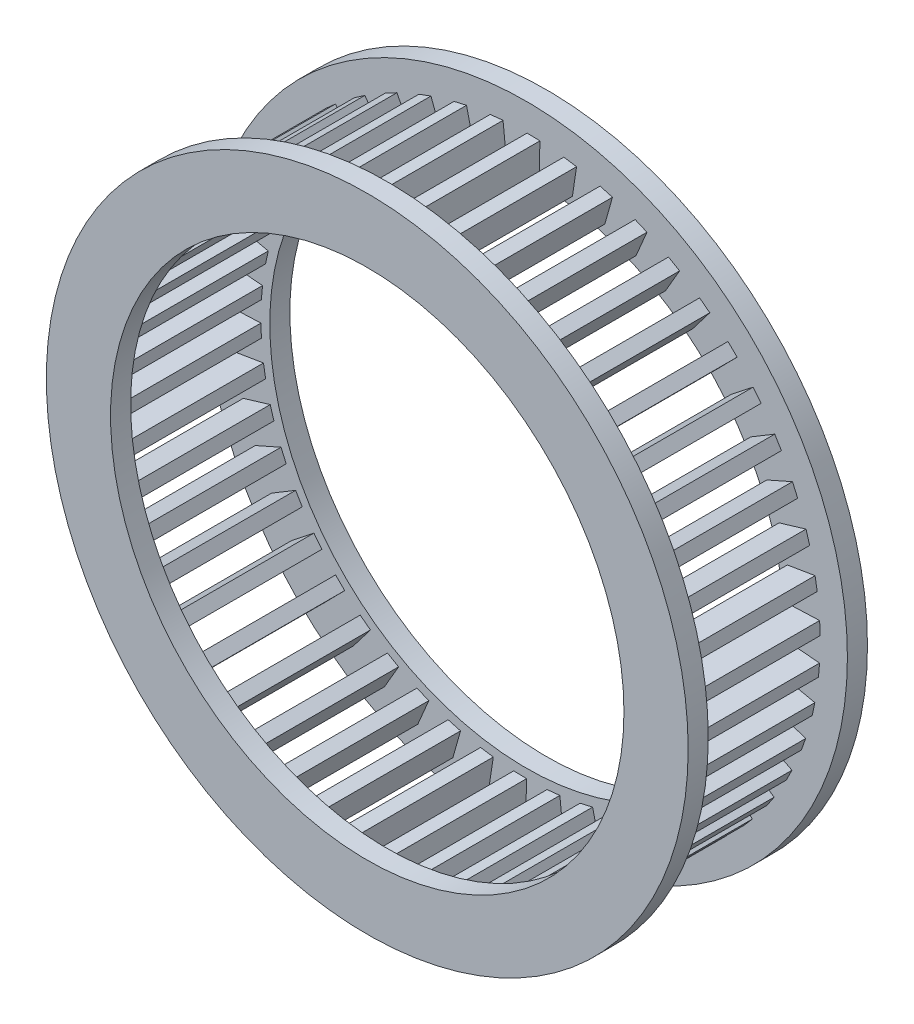
from build123d import *

# Parameters (mm, degrees)
CAGE_50_BARS_START    = -20.1
CAGE_50_BARS_DEPTH    = 40.2
CAGE_50_BARS_2_DEPTH  = 40.2
CAGE_50_BARS_3_DEPTH  = 40.2
CAGE_50_BARS_4_DEPTH  = 40.2
CAGE_50_BARS_5_DEPTH  = 40.2
CAGE_50_BARS_6_DEPTH  = 40.2
CAGE_50_BARS_7_DEPTH  = 40.2
CAGE_50_BARS_8_DEPTH  = 40.2
CAGE_50_BARS_9_DEPTH  = 40.2
CAGE_50_BARS_10_DEPTH = 40.2
CAGE_50_BARS_11_DEPTH = 40.2
CAGE_50_BARS_12_DEPTH = 40.2
CAGE_50_BARS_13_DEPTH = 40.2
CAGE_50_BARS_14_DEPTH = 40.2
CAGE_50_BARS_15_DEPTH = 40.2
CAGE_50_BARS_16_DEPTH = 40.2
CAGE_50_BARS_17_DEPTH = 40.2
CAGE_50_BARS_18_DEPTH = 40.2
CAGE_50_BARS_19_DEPTH = 40.2
CAGE_50_BARS_20_DEPTH = 40.2
CAGE_50_BARS_21_DEPTH = 40.2
CAGE_50_BARS_22_DEPTH = 40.2
CAGE_50_BARS_23_DEPTH = 40.2
CAGE_50_BARS_24_DEPTH = 40.2
CAGE_50_BARS_25_DEPTH = 40.2
CAGE_50_BARS_26_DEPTH = 40.2
CAGE_50_BARS_27_DEPTH = 40.2
CAGE_50_BARS_28_DEPTH = 40.2
CAGE_50_BARS_29_DEPTH = 40.2
CAGE_50_BARS_30_DEPTH = 40.2
CAGE_50_BARS_31_DEPTH = 40.2
CAGE_50_BARS_32_DEPTH = 40.2
CAGE_50_BARS_33_DEPTH = 40.2
CAGE_50_BARS_34_DEPTH = 40.2
CAGE_50_BARS_35_DEPTH = 40.2
CAGE_50_BARS_36_DEPTH = 40.2
CAGE_50_BARS_37_DEPTH = 40.2
CAGE_50_BARS_38_DEPTH = 40.2
CAGE_50_BARS_39_DEPTH = 40.2
CAGE_50_BARS_40_DEPTH = 40.2
CAGE_50_BARS_41_DEPTH = 40.2
CAGE_50_BARS_42_DEPTH = 40.2
CAGE_50_BARS_43_DEPTH = 40.2
CAGE_50_BARS_44_DEPTH = 40.2
CAGE_50_BARS_45_DEPTH = 40.2
CAGE_50_BARS_46_DEPTH = 40.2
CAGE_50_BARS_47_DEPTH = 40.2
CAGE_50_BARS_48_DEPTH = 40.2
CAGE_50_BARS_49_DEPTH = 40.2
CAGE_50_BARS_50_DEPTH = 40.2
CAGE_RING_RIGHT_START = 20
SKETCH_2_R            = 92.246153846
SKETCH_2_R_2          = 73.784615385
CAGE_RING_RIGHT_DEPTH = 5.769230769
CAGE_RING_LEFT_START  = -25.769230769
SKETCH_3_R            = 92.246153846
SKETCH_3_R_2          = 73.784615385
CAGE_RING_LEFT_DEPTH  = 5.769230769


with BuildPart() as part:
    # Эскиз1 → Cage_50_bars (new body)
    with BuildSketch(Plane.XY.offset(CAGE_50_BARS_START)):
        Polygon((76.337072307, 1.127717467), (84.40786759, 1.44228048), (84.264067355, 5.131786895), (76.193272072, 4.817223882), align=None)
    extrude(amount=CAGE_50_BARS_DEPTH)



with BuildPart() as body_2:
    # Эскиз1 → Cage_50_bars 2 (new body)
    with BuildSketch(Plane.XY.offset(CAGE_50_BARS_START)):
        Polygon((75.593791214, 10.686397191), (83.561520666, 12.01001865), (82.95643657, 15.652409257), (74.988707118, 14.328787798), align=None)
    extrude(amount=CAGE_50_BARS_2_DEPTH)


with BuildPart() as body_3:
    # Эскиз1 → Cage_50_bars 3 (new body)
    with BuildSketch(Plane.XY.offset(CAGE_50_BARS_START)):
        Polygon((73.658350876, 20.076546048), (81.397358644, 22.388351653), (80.340533225, 25.926183775), (72.601525457, 23.61437817), align=None)
    extrude(amount=CAGE_50_BARS_3_DEPTH)


with BuildPart() as body_4:
    # Эскиз1 → Cage_50_bars 4 (new body)
    with BuildSketch(Plane.XY.offset(CAGE_50_BARS_START)):
        Polygon((70.561274344, 29.15007578), (77.949511652, 32.413606975), (76.457611677, 35.791086888), (69.069374369, 32.527555692), align=None)
    extrude(amount=CAGE_50_BARS_4_DEPTH)


with BuildPart() as body_5:
    # Эскиз1 → Cage_50_bars 5 (new body)
    with BuildSketch(Plane.XY.offset(CAGE_50_BARS_START)):
        Polygon((66.351404364, 37.763891404), (73.272354297, 41.927680353), (71.36890792, 45.09154318), (64.447957987, 40.92775423), align=None)
    extrude(amount=CAGE_50_BARS_5_DEPTH)


with BuildPart() as body_6:
    # Эскиз1 → Cage_50_bars 6 (new body)
    with BuildSketch(Plane.XY.offset(CAGE_50_BARS_START)):
        Polygon((61.095133101, 45.782147901), (67.439648143, 50.780529165), (65.154673851, 53.680878899), (58.810158809, 48.682497635), align=None)
    extrude(amount=CAGE_50_BARS_6_DEPTH)


with BuildPart() as body_7:
    # Эскиз1 → Cage_50_bars 7 (new body)
    with BuildSketch(Plane.XY.offset(CAGE_50_BARS_START)):
        Polygon((54.875355092, 53.078392577), (60.543378452, 58.832538698), (57.912911654, 61.423635091), (52.244888294, 55.66948897), align=None)
    extrude(amount=CAGE_50_BARS_7_DEPTH)


with BuildPart() as body_8:
    # Эскиз1 → Cage_50_bars 8 (new body)
    with BuildSketch(Plane.XY.offset(CAGE_50_BARS_START)):
        Polygon((47.790159953, 59.537559294), (52.692303516, 65.95672395), (49.757828245, 68.197703865), (44.855684682, 61.778539209), align=None)
    extrude(amount=CAGE_50_BARS_8_DEPTH)


with BuildPart() as body_9:
    # Эскиз1 → Cage_50_bars 9 (new body)
    with BuildSketch(Plane.XY.offset(CAGE_50_BARS_START)):
        Polygon((39.951285442, 65.057783136), (44.010239476, 72.040732265), (40.81803416, 73.896254109), (36.759080126, 66.91330498), align=None)
    extrude(amount=CAGE_50_BARS_9_DEPTH)


with BuildPart() as body_10:
    # Эскиз1 → Cage_50_bars 10 (new body)
    with BuildSketch(Plane.XY.offset(CAGE_50_BARS_START)):
        Polygon((31.482355295, 69.552006873), (34.63410767, 76.988615197), (31.234515293, 78.429416283), (28.082762918, 70.992807959), align=None)
    extrude(amount=CAGE_50_BARS_10_DEPTH)


with BuildPart() as body_11:
    # Эскиз1 → Cage_50_bars 11 (new body)
    with BuildSketch(Plane.XY.offset(CAGE_50_BARS_START)):
        Polygon((22.516929598, 72.949353914), (24.711775296, 80.722341677), (21.158409462, 81.72569971), (18.963563764, 73.952711948), align=None)
    extrude(amount=CAGE_50_BARS_11_DEPTH)


with BuildPart() as body_12:
    # Эскиз1 → Cage_50_bars 12 (new body)
    with BuildSketch(Plane.XY.offset(CAGE_50_BARS_START)):
        Polygon((13.19639847, 75.196246066), (14.399723463, 83.183028607), (10.748622873, 83.733120032), (9.54529788, 75.746337492), align=None)
    extrude(amount=CAGE_50_BARS_12_DEPTH)


with BuildPart() as body_13:
    # Эскиз1 → Cage_50_bars 13 (new body)
    with BuildSketch(Plane.XY.offset(CAGE_50_BARS_START)):
        Polygon((3.667752255, 76.257248498), (3.86057939, 84.331869485), (0.169324081, 84.420019032), (-0.023503053, 76.345398045), align=None)
    extrude(amount=CAGE_50_BARS_13_DEPTH)


with BuildPart() as body_14:
    # Эскиз1 → Cage_50_bars 14 (new body)
    with BuildSketch(Plane.XY.offset(CAGE_50_BARS_START)):
        Polygon((-5.918736604, 76.115628566), (-6.739448327, 84.150746404), (-10.412645052, 83.775563902), (-9.591933329, 75.740446064), align=None)
    extrude(amount=CAGE_50_BARS_14_DEPTH)


with BuildPart() as body_15:
    # Эскиз1 → Cage_50_bars 15 (new body)
    with BuildSketch(Plane.XY.offset(CAGE_50_BARS_START)):
        Polygon((-15.411883451, 74.773619703), (-17.233190917, 82.642515782), (-20.830400554, 81.809918083), (-19.009093087, 73.941022004), align=None)
    extrude(amount=CAGE_50_BARS_15_DEPTH)


with BuildPart() as body_16:
    # Эскиз1 → Cage_50_bars 16 (new body)
    with BuildSketch(Plane.XY.offset(CAGE_50_BARS_START)):
        Polygon((-24.661975689, 72.25238619), (-27.455155793, 79.830963319), (-30.919648194, 78.554080986), (-28.126468091, 70.975503857), align=None)
    extrude(amount=CAGE_50_BARS_16_DEPTH)


with BuildPart() as body_17:
    # Эскиз1 → Cage_50_bars 17 (new body)
    with BuildSketch(Plane.XY.offset(CAGE_50_BARS_START)):
        Polygon((-33.523133839, 68.591689385), (-37.24413646, 75.760428875), (-40.521274513, 74.059399106), (-36.800271892, 66.890659615), align=None)
    extrude(amount=CAGE_50_BARS_17_DEPTH)


with BuildPart() as body_18:
    # Эскиз1 → Cage_50_bars 18 (new body)
    with BuildSketch(Plane.XY.offset(CAGE_50_BARS_START)):
        Polygon((-41.855612142, 63.849260663), (-46.445754847, 70.495107211), (-49.483856126, 68.39675626), (-44.893713421, 61.750909713), align=None)
    extrude(amount=CAGE_50_BARS_18_DEPTH)


with BuildPart() as body_19:
    # Эскиз1 → Cage_50_bars 19 (new body)
    with BuildSketch(Plane.XY.offset(CAGE_50_BARS_START)):
        Polygon((-49.528002438, 58.09989096), (-54.914895935, 64.118035595), (-57.666047768, 61.655455711), (-52.279154271, 55.637311076), align=None)
    extrude(amount=CAGE_50_BARS_19_DEPTH)


with BuildPart() as body_20:
    # Эскиз1 → Cage_50_bars 20 (new body)
    with BuildSketch(Plane.XY.offset(CAGE_50_BARS_START)):
        Polygon((-56.419306549, 51.434251268), (-62.517996309, 56.729784255), (-64.938811388, 53.941811793), (-58.840121629, 48.646278807), align=None)
    extrude(amount=CAGE_50_BARS_20_DEPTH)


with BuildPart() as body_21:
    # Эскиз1 → Cage_50_bars 21 (new body)
    with BuildSketch(Plane.XY.offset(CAGE_50_BARS_START)):
        Polygon((-62.420844493, 43.957462709), (-69.135150535, 48.446870328), (-71.18745116, 45.37747328), (-64.473145119, 40.888065662), align=None)
    extrude(amount=CAGE_50_BARS_21_DEPTH)


with BuildPart() as body_22:
    # Эскиз1 → Cage_50_bars 22 (new body)
    with BuildSketch(Plane.XY.offset(CAGE_50_BARS_START)):
        Polygon((-67.43796843, 35.787438704), (-74.662002137, 39.399920316), (-76.313422303, 36.097504907), (-69.089388596, 32.485023295), align=None)
    extrude(amount=CAGE_50_BARS_22_DEPTH)


with BuildPart() as body_23:
    # Эскиз1 → Cage_50_bars 23 (new body)
    with BuildSketch(Plane.XY.offset(CAGE_50_BARS_START)):
        Polygon((-71.39155532, 27.053025412), (-79.011389365, 29.731610024), (-80.235885188, 26.248257317), (-72.616051143, 23.569672706), align=None)
    extrude(amount=CAGE_50_BARS_23_DEPTH)


with BuildPart() as body_24:
    # Эскиз1 → Cage_50_bars 24 (new body)
    with BuildSketch(Plane.XY.offset(CAGE_50_BARS_START)):
        Polygon((-74.219254736, 17.891969749), (-82.114719784, 19.594414481), (-82.892980233, 15.98505903), (-74.997515184, 14.282614299), align=None)
    extrude(amount=CAGE_50_BARS_24_DEPTH)


with BuildPart() as body_25:
    # Эскиз1 → Cage_50_bars 25 (new body)
    with BuildSketch(Plane.XY.offset(CAGE_50_BARS_START)):
        Polygon((-75.876472167, 8.448747035), (-83.923052019, 9.148203316), (-84.242803461, 5.469766813), (-76.19622361, 4.770310531), align=None)
    extrude(amount=CAGE_50_BARS_25_DEPTH)


with BuildPart() as body_26:
    # Эскиз1 → Cage_50_bars 26 (new body)
    with BuildSketch(Plane.XY.offset(CAGE_50_BARS_START)):
        Polygon((-76.337072307, -1.127717467), (-84.40786759, -1.44228048), (-84.264067355, -5.131786895), (-76.193272072, -4.817223882), align=None)
    extrude(amount=CAGE_50_BARS_26_DEPTH)


with BuildPart() as body_27:
    # Эскиз1 → Cage_50_bars 27 (new body)
    with BuildSketch(Plane.XY.offset(CAGE_50_BARS_START)):
        Polygon((-75.593791214, -10.686397191), (-83.561520666, -12.01001865), (-82.95643657, -15.652409257), (-74.988707118, -14.328787798), align=None)
    extrude(amount=CAGE_50_BARS_27_DEPTH)


with BuildPart() as body_28:
    # Эскиз1 → Cage_50_bars 28 (new body)
    with BuildSketch(Plane.XY.offset(CAGE_50_BARS_START)):
        Polygon((-73.658350876, -20.076546048), (-81.397358644, -22.388351653), (-80.340533225, -25.926183775), (-72.601525457, -23.61437817), align=None)
    extrude(amount=CAGE_50_BARS_28_DEPTH)


with BuildPart() as body_29:
    # Эскиз1 → Cage_50_bars 29 (new body)
    with BuildSketch(Plane.XY.offset(CAGE_50_BARS_START)):
        Polygon((-70.561274344, -29.15007578), (-77.949511652, -32.413606975), (-76.457611677, -35.791086888), (-69.069374369, -32.527555692), align=None)
    extrude(amount=CAGE_50_BARS_29_DEPTH)


with BuildPart() as body_30:
    # Эскиз1 → Cage_50_bars 30 (new body)
    with BuildSketch(Plane.XY.offset(CAGE_50_BARS_START)):
        Polygon((-66.351404364, -37.763891404), (-73.272354297, -41.927680353), (-71.36890792, -45.09154318), (-64.447957987, -40.92775423), align=None)
    extrude(amount=CAGE_50_BARS_30_DEPTH)


with BuildPart() as body_31:
    # Эскиз1 → Cage_50_bars 31 (new body)
    with BuildSketch(Plane.XY.offset(CAGE_50_BARS_START)):
        Polygon((-61.095133101, -45.782147901), (-67.439648143, -50.780529165), (-65.154673851, -53.680878899), (-58.810158809, -48.682497635), align=None)
    extrude(amount=CAGE_50_BARS_31_DEPTH)


with BuildPart() as body_32:
    # Эскиз1 → Cage_50_bars 32 (new body)
    with BuildSketch(Plane.XY.offset(CAGE_50_BARS_START)):
        Polygon((-54.875355092, -53.078392577), (-60.543378452, -58.832538698), (-57.912911654, -61.423635091), (-52.244888294, -55.66948897), align=None)
    extrude(amount=CAGE_50_BARS_32_DEPTH)


with BuildPart() as body_33:
    # Эскиз1 → Cage_50_bars 33 (new body)
    with BuildSketch(Plane.XY.offset(CAGE_50_BARS_START)):
        Polygon((-47.790159953, -59.537559294), (-52.692303516, -65.95672395), (-49.757828245, -68.197703865), (-44.855684682, -61.778539209), align=None)
    extrude(amount=CAGE_50_BARS_33_DEPTH)


with BuildPart() as body_34:
    # Эскиз1 → Cage_50_bars 34 (new body)
    with BuildSketch(Plane.XY.offset(CAGE_50_BARS_START)):
        Polygon((-39.951285442, -65.057783136), (-44.010239476, -72.040732265), (-40.81803416, -73.896254109), (-36.759080126, -66.91330498), align=None)
    extrude(amount=CAGE_50_BARS_34_DEPTH)


with BuildPart() as body_35:
    # Эскиз1 → Cage_50_bars 35 (new body)
    with BuildSketch(Plane.XY.offset(CAGE_50_BARS_START)):
        Polygon((-31.482355295, -69.552006873), (-34.63410767, -76.988615197), (-31.234515293, -78.429416283), (-28.082762918, -70.992807959), align=None)
    extrude(amount=CAGE_50_BARS_35_DEPTH)


with BuildPart() as body_36:
    # Эскиз1 → Cage_50_bars 36 (new body)
    with BuildSketch(Plane.XY.offset(CAGE_50_BARS_START)):
        Polygon((-22.516929598, -72.949353914), (-24.711775296, -80.722341677), (-21.158409462, -81.72569971), (-18.963563764, -73.952711948), align=None)
    extrude(amount=CAGE_50_BARS_36_DEPTH)


with BuildPart() as body_37:
    # Эскиз1 → Cage_50_bars 37 (new body)
    with BuildSketch(Plane.XY.offset(CAGE_50_BARS_START)):
        Polygon((-13.19639847, -75.196246066), (-14.399723463, -83.183028607), (-10.748622873, -83.733120032), (-9.54529788, -75.746337492), align=None)
    extrude(amount=CAGE_50_BARS_37_DEPTH)


with BuildPart() as body_38:
    # Эскиз1 → Cage_50_bars 38 (new body)
    with BuildSketch(Plane.XY.offset(CAGE_50_BARS_START)):
        Polygon((-3.667752255, -76.257248498), (-3.86057939, -84.331869485), (-0.169324081, -84.420019032), (0.023503053, -76.345398045), align=None)
    extrude(amount=CAGE_50_BARS_38_DEPTH)


with BuildPart() as body_39:
    # Эскиз1 → Cage_50_bars 39 (new body)
    with BuildSketch(Plane.XY.offset(CAGE_50_BARS_START)):
        Polygon((5.918736604, -76.115628566), (6.739448327, -84.150746404), (10.412645052, -83.775563902), (9.591933329, -75.740446064), align=None)
    extrude(amount=CAGE_50_BARS_39_DEPTH)


with BuildPart() as body_40:
    # Эскиз1 → Cage_50_bars 40 (new body)
    with BuildSketch(Plane.XY.offset(CAGE_50_BARS_START)):
        Polygon((15.411883451, -74.773619703), (17.233190917, -82.642515782), (20.830400554, -81.809918083), (19.009093087, -73.941022004), align=None)
    extrude(amount=CAGE_50_BARS_40_DEPTH)


with BuildPart() as body_41:
    # Эскиз1 → Cage_50_bars 41 (new body)
    with BuildSketch(Plane.XY.offset(CAGE_50_BARS_START)):
        Polygon((24.661975689, -72.25238619), (27.455155793, -79.830963319), (30.919648194, -78.554080986), (28.126468091, -70.975503857), align=None)
    extrude(amount=CAGE_50_BARS_41_DEPTH)


with BuildPart() as body_42:
    # Эскиз1 → Cage_50_bars 42 (new body)
    with BuildSketch(Plane.XY.offset(CAGE_50_BARS_START)):
        Polygon((33.523133839, -68.591689385), (37.24413646, -75.760428875), (40.521274513, -74.059399106), (36.800271892, -66.890659615), align=None)
    extrude(amount=CAGE_50_BARS_42_DEPTH)


with BuildPart() as body_43:
    # Эскиз1 → Cage_50_bars 43 (new body)
    with BuildSketch(Plane.XY.offset(CAGE_50_BARS_START)):
        Polygon((41.855612142, -63.849260663), (46.445754847, -70.495107211), (49.483856126, -68.39675626), (44.893713421, -61.750909713), align=None)
    extrude(amount=CAGE_50_BARS_43_DEPTH)


with BuildPart() as body_44:
    # Эскиз1 → Cage_50_bars 44 (new body)
    with BuildSketch(Plane.XY.offset(CAGE_50_BARS_START)):
        Polygon((49.528002438, -58.09989096), (54.914895935, -64.118035595), (57.666047768, -61.655455711), (52.279154271, -55.637311076), align=None)
    extrude(amount=CAGE_50_BARS_44_DEPTH)


with BuildPart() as body_45:
    # Эскиз1 → Cage_50_bars 45 (new body)
    with BuildSketch(Plane.XY.offset(CAGE_50_BARS_START)):
        Polygon((56.419306549, -51.434251268), (62.517996309, -56.729784255), (64.938811388, -53.941811793), (58.840121629, -48.646278807), align=None)
    extrude(amount=CAGE_50_BARS_45_DEPTH)


with BuildPart() as body_46:
    # Эскиз1 → Cage_50_bars 46 (new body)
    with BuildSketch(Plane.XY.offset(CAGE_50_BARS_START)):
        Polygon((62.420844493, -43.957462709), (69.135150535, -48.446870328), (71.18745116, -45.37747328), (64.473145119, -40.888065662), align=None)
    extrude(amount=CAGE_50_BARS_46_DEPTH)


with BuildPart() as body_47:
    # Эскиз1 → Cage_50_bars 47 (new body)
    with BuildSketch(Plane.XY.offset(CAGE_50_BARS_START)):
        Polygon((67.43796843, -35.787438704), (74.662002137, -39.399920316), (76.313422303, -36.097504907), (69.089388596, -32.485023295), align=None)
    extrude(amount=CAGE_50_BARS_47_DEPTH)


with BuildPart() as body_48:
    # Эскиз1 → Cage_50_bars 48 (new body)
    with BuildSketch(Plane.XY.offset(CAGE_50_BARS_START)):
        Polygon((71.39155532, -27.053025412), (79.011389365, -29.731610024), (80.235885188, -26.248257317), (72.616051143, -23.569672706), align=None)
    extrude(amount=CAGE_50_BARS_48_DEPTH)


with BuildPart() as body_49:
    # Эскиз1 → Cage_50_bars 49 (new body)
    with BuildSketch(Plane.XY.offset(CAGE_50_BARS_START)):
        Polygon((74.219254736, -17.891969749), (82.114719784, -19.594414481), (82.892980233, -15.98505903), (74.997515184, -14.282614299), align=None)
    extrude(amount=CAGE_50_BARS_49_DEPTH)


with BuildPart() as body_50:
    # Эскиз1 → Cage_50_bars 50 (new body)
    with BuildSketch(Plane.XY.offset(CAGE_50_BARS_START)):
        Polygon((75.876472167, -8.448747035), (83.923052019, -9.148203316), (84.242803461, -5.469766813), (76.19622361, -4.770310531), align=None)
    extrude(amount=CAGE_50_BARS_50_DEPTH)


with BuildPart() as part_1:
    add(part.part)

    add(body_2.part)  # Cage_ring_right merges body 2

    add(body_3.part)  # Cage_ring_right merges body 3

    add(body_4.part)  # Cage_ring_right merges body 4

    add(body_5.part)  # Cage_ring_right merges body 5

    add(body_6.part)  # Cage_ring_right merges body 6

    add(body_7.part)  # Cage_ring_right merges body 7

    add(body_8.part)  # Cage_ring_right merges body 8

    add(body_9.part)  # Cage_ring_right merges body 9

    add(body_10.part)  # Cage_ring_right merges body 10

    add(body_11.part)  # Cage_ring_right merges body 11

    add(body_12.part)  # Cage_ring_right merges body 12

    add(body_13.part)  # Cage_ring_right merges body 13

    add(body_14.part)  # Cage_ring_right merges body 14

    add(body_15.part)  # Cage_ring_right merges body 15

    add(body_16.part)  # Cage_ring_right merges body 16

    add(body_17.part)  # Cage_ring_right merges body 17

    add(body_18.part)  # Cage_ring_right merges body 18

    add(body_19.part)  # Cage_ring_right merges body 19

    add(body_20.part)  # Cage_ring_right merges body 20

    add(body_21.part)  # Cage_ring_right merges body 21

    add(body_22.part)  # Cage_ring_right merges body 22

    add(body_23.part)  # Cage_ring_right merges body 23

    add(body_24.part)  # Cage_ring_right merges body 24

    add(body_25.part)  # Cage_ring_right merges body 25

    add(body_26.part)  # Cage_ring_right merges body 26

    add(body_27.part)  # Cage_ring_right merges body 27

    add(body_28.part)  # Cage_ring_right merges body 28

    add(body_29.part)  # Cage_ring_right merges body 29

    add(body_30.part)  # Cage_ring_right merges body 30

    add(body_31.part)  # Cage_ring_right merges body 31

    add(body_32.part)  # Cage_ring_right merges body 32

    add(body_33.part)  # Cage_ring_right merges body 33

    add(body_34.part)  # Cage_ring_right merges body 34

    add(body_35.part)  # Cage_ring_right merges body 35

    add(body_36.part)  # Cage_ring_right merges body 36

    add(body_37.part)  # Cage_ring_right merges body 37

    add(body_38.part)  # Cage_ring_right merges body 38

    add(body_39.part)  # Cage_ring_right merges body 39

    add(body_40.part)  # Cage_ring_right merges body 40

    add(body_41.part)  # Cage_ring_right merges body 41

    add(body_42.part)  # Cage_ring_right merges body 42

    add(body_43.part)  # Cage_ring_right merges body 43

    add(body_44.part)  # Cage_ring_right merges body 44

    add(body_45.part)  # Cage_ring_right merges body 45

    add(body_46.part)  # Cage_ring_right merges body 46

    add(body_47.part)  # Cage_ring_right merges body 47

    add(body_48.part)  # Cage_ring_right merges body 48

    add(body_49.part)  # Cage_ring_right merges body 49

    add(body_50.part)  # Cage_ring_right merges body 50
    # Эскиз2 → Cage_ring_right (add)
    with BuildSketch(Plane.XY.offset(CAGE_RING_RIGHT_START)):
        Circle(SKETCH_2_R)
        Circle(SKETCH_2_R_2, mode=Mode.SUBTRACT)
    extrude(amount=CAGE_RING_RIGHT_DEPTH)

    # Эскиз3 → Cage_ring_left (add)
    with BuildSketch(Plane.XY.offset(CAGE_RING_LEFT_START)):
        Circle(SKETCH_3_R)
        Circle(SKETCH_3_R_2, mode=Mode.SUBTRACT)
    extrude(amount=CAGE_RING_LEFT_DEPTH)


solid = part_1.part
